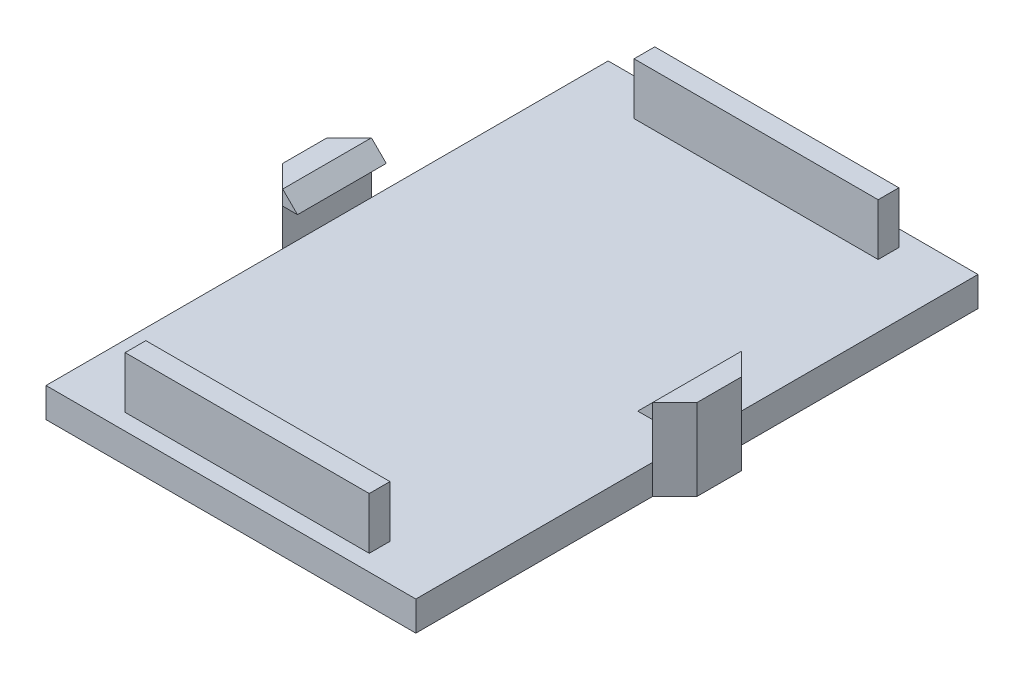
from build123d import *

# Parameters (mm, degrees)
SKETCH1_W                = 25
SKETCH1_H                = 38
SKETCH1_W_2              = 16.5
SKETCH1_H_2              = 1.4
BOSS_EXTRUDE1_DEPTH      = 2
SKETCH1_3_W              = 16.5
SKETCH1_3_H              = 1.4
BOSS_EXTRUDE2_DEPTH      = 5.5
BOSS_EXTRUDE3_DEPTH      = 3
BOSS_EXTRUDE3_DEPTH_BACK = 3


with BuildPart() as part:
    # Sketch1 → Boss-Extrude1 (new body)
    with BuildSketch(Plane(origin=(0, 0, 0), x_dir=(1, 0, 0), z_dir=(0, 1, 0))):
        Rectangle(SKETCH1_W, SKETCH1_H)
        with Locations((0, -17.2)):
            Rectangle(SKETCH1_W_2, SKETCH1_H_2, mode=Mode.SUBTRACT)
        with Locations((0, 17.2)):
            Rectangle(SKETCH1_W_2, SKETCH1_H_2, mode=Mode.SUBTRACT)
    extrude(amount=BOSS_EXTRUDE1_DEPTH)

    # Sketch1<3> → Boss-Extrude2 (add)
    with BuildSketch(Plane(origin=(0, 0, 0), x_dir=(1, 0, 0), z_dir=(0, 1, 0))):
        Polygon((-14, -1.5), (-12.5, -3), (-12.5, 3), (-14, 1.5), align=None)
        Polygon((12.5, 3), (12.5, -3), (14, -1.5), (14, 1.5), align=None)
        with Locations((0, 17.2)):
            Rectangle(SKETCH1_3_W, SKETCH1_3_H)
        with Locations((0, -17.2)):
            Rectangle(SKETCH1_3_W, SKETCH1_3_H)
    extrude(amount=BOSS_EXTRUDE2_DEPTH)

    # Sketch2 → Boss-Extrude3 (add, two sides: drawn at the far end of the back side and taken through both)
    with BuildSketch(Plane.XY.offset(-BOSS_EXTRUDE3_DEPTH_BACK)):
        Polygon((12.5, 5.5), (11.5, 4.5), (12.5, 4.5), align=None)
        Polygon((-11.5, 4.5), (-12.5, 4.5), (-12.5, 5.5), align=None)
    extrude(amount=BOSS_EXTRUDE3_DEPTH + BOSS_EXTRUDE3_DEPTH_BACK)


solid = part.part
